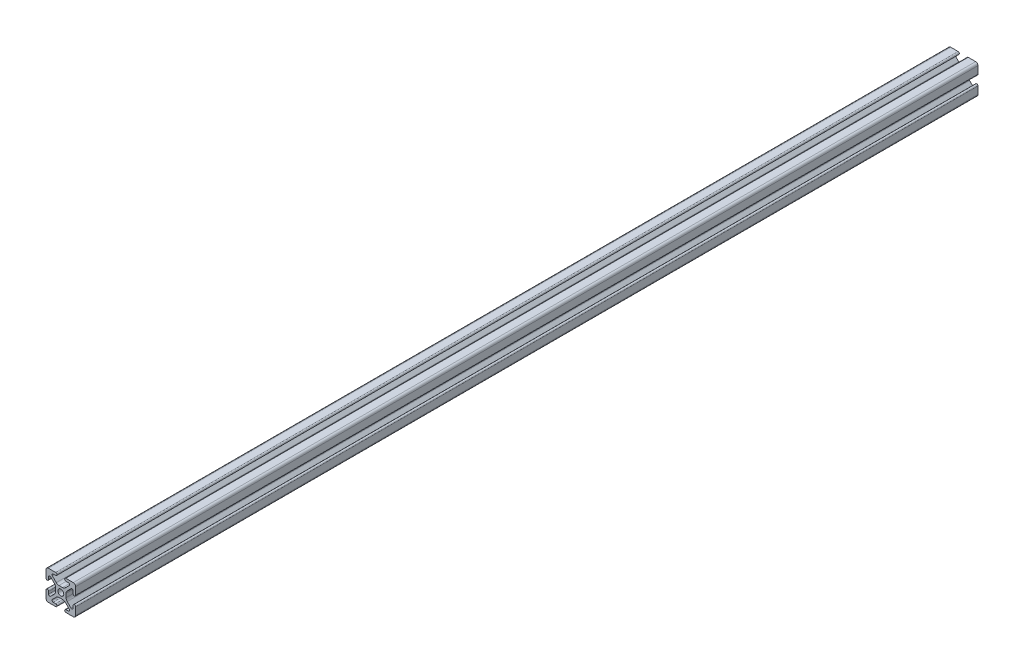
from build123d import *

# Parameters (mm, degrees)
SKETCH1_R      = 2.5
EXTRUDE1_DEPTH = 762


with BuildPart() as part:
    # Sketch1 → Extrude1 (new body)
    with BuildSketch(Plane.XY):
        with BuildLine():
            Line((-8.636346088, 7.111588351), (-5.432204773, 3.912143135))
            ThreePointArc((-5.432204773, 3.912143135), (-4.708985779, 2.831057106), (-4.455, 1.555406707))
            Line((-4.455, 1.555406707), (-4.455, -1.555406707))
            ThreePointArc((-4.455, -1.555406707), (-4.708985779, -2.831057106), (-5.432204773, -3.912143135))
            Line((-5.432204773, -3.912143135), (-8.636346088, -7.111588351))
            ThreePointArc((-8.636346088, -7.111588351), (-9.736852394, -7.329863489), (-10.36, -6.396886949))
            Line((-10.36, -6.396886949), (-10.36, -4.32))
            ThreePointArc((-10.36, -4.32), (-11.43, -3.25), (-12.5, -4.32))
            Line((-12.5, -4.32), (-12.5, -8.651801989))
            Line((-12.5, -8.651801989), (-12.5, -10.537068835))
            ThreePointArc((-12.5, -10.537068835), (-11.925070773, -11.925070773), (-10.537068835, -12.5))
            Line((-10.537068835, -12.5), (-8.441567612, -12.5))
            Line((-8.441567612, -12.5), (-4.387856959, -12.5))
            ThreePointArc((-4.387856959, -12.5), (-3.317856959, -11.43), (-4.387856959, -10.36))
            Line((-4.387856959, -10.36), (-6.42, -10.36))
            ThreePointArc((-6.42, -10.36), (-7.35325999, -9.736168088), (-7.133653912, -8.635298598))
            Line((-7.133653912, -8.635298598), (-3.795290766, -5.301828272))
            ThreePointArc((-3.795290766, -5.301828272), (-2.76743922, -4.61585726), (-1.555406707, -4.375))
            Line((-1.555406707, -4.375), (1.555406707, -4.375))
            ThreePointArc((1.555406707, -4.375), (2.76743922, -4.61585726), (3.795290766, -5.301828272))
            Line((3.795290766, -5.301828272), (7.133653912, -8.635298598))
            ThreePointArc((7.133653912, -8.635298598), (7.35325999, -9.736168088), (6.42, -10.36))
            Line((6.42, -10.36), (4.387856959, -10.36))
            ThreePointArc((4.387856959, -10.36), (3.317856959, -11.43), (4.387856959, -12.5))
            Line((4.387856959, -12.5), (8.441567612, -12.5))
            Line((8.441567612, -12.5), (10.537068835, -12.5))
            ThreePointArc((10.537068835, -12.5), (11.925070773, -11.925070773), (12.5, -10.537068835))
            Line((12.5, -10.537068835), (12.5, -8.651801989))
            Line((12.5, -8.651801989), (12.5, -4.32))
            ThreePointArc((12.5, -4.32), (11.43, -3.25), (10.36, -4.32))
            Line((10.36, -4.32), (10.36, -6.396886949))
            ThreePointArc((10.36, -6.396886949), (9.736852394, -7.329863489), (8.636346088, -7.111588351))
            Line((8.636346088, -7.111588351), (5.432204773, -3.912143135))
            ThreePointArc((5.432204773, -3.912143135), (4.708985779, -2.831057106), (4.455, -1.555406707))
            Line((4.455, -1.555406707), (4.455, 1.555406707))
            ThreePointArc((4.455, 1.555406707), (4.708985779, 2.831057106), (5.432204773, 3.912143135))
            Line((5.432204773, 3.912143135), (8.636346088, 7.111588351))
            ThreePointArc((8.636346088, 7.111588351), (9.736852394, 7.329863489), (10.36, 6.396886949))
            Line((10.36, 6.396886949), (10.36, 4.32))
            ThreePointArc((10.36, 4.32), (11.43, 3.25), (12.5, 4.32))
            Line((12.5, 4.32), (12.5, 7.99129648))
            Line((12.5, 7.99129648), (12.5, 10.537068835))
            ThreePointArc((12.5, 10.537068835), (11.925070773, 11.925070773), (10.537068835, 12.5))
            Line((10.537068835, 12.5), (4.32, 12.5))
            ThreePointArc((4.32, 12.5), (3.25, 11.43), (4.32, 10.36))
            Line((4.32, 10.36), (6.42, 10.36))
            ThreePointArc((6.42, 10.36), (7.35325999, 9.736168088), (7.133653912, 8.635298598))
            Line((7.133653912, 8.635298598), (3.795290766, 5.301828272))
            ThreePointArc((3.795290766, 5.301828272), (2.76743922, 4.61585726), (1.555406707, 4.375))
            Line((1.555406707, 4.375), (-1.555406707, 4.375))
            ThreePointArc((-1.555406707, 4.375), (-2.76743922, 4.61585726), (-3.795290766, 5.301828272))
            Line((-3.795290766, 5.301828272), (-7.133653912, 8.635298598))
            ThreePointArc((-7.133653912, 8.635298598), (-7.35325999, 9.736168088), (-6.42, 10.36))
            Line((-6.42, 10.36), (-4.32, 10.36))
            ThreePointArc((-4.32, 10.36), (-3.25, 11.43), (-4.32, 12.5))
            Line((-4.32, 12.5), (-10.537068835, 12.5))
            ThreePointArc((-10.537068835, 12.5), (-11.925070773, 11.925070773), (-12.5, 10.537068835))
            Line((-12.5, 10.537068835), (-12.5, 7.99129648))
            Line((-12.5, 7.99129648), (-12.5, 4.32))
            ThreePointArc((-12.5, 4.32), (-11.43, 3.25), (-10.36, 4.32))
            Line((-10.36, 4.32), (-10.36, 6.396886949))
            ThreePointArc((-10.36, 6.396886949), (-9.736852394, 7.329863489), (-8.636346088, 7.111588351))
        make_face()
        Circle(SKETCH1_R, mode=Mode.SUBTRACT)
    extrude(amount=-EXTRUDE1_DEPTH)


solid = part.part
